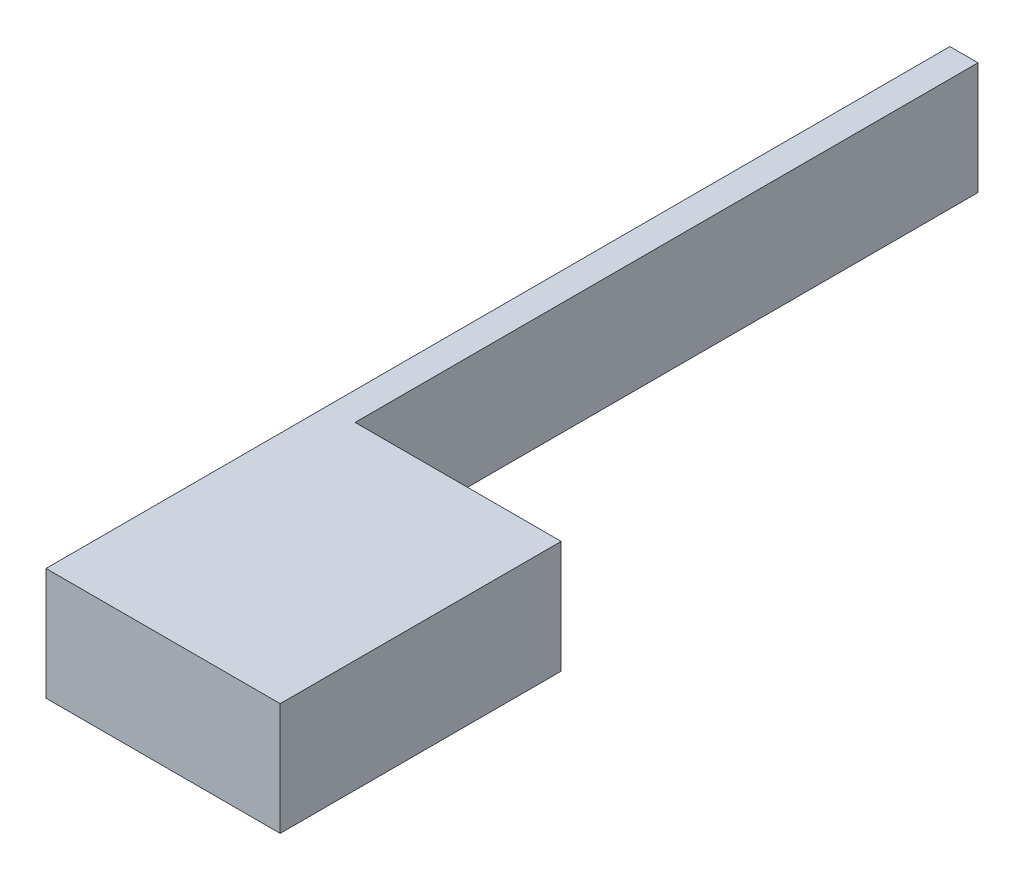
from build123d import *

# Parameters (mm, degrees)
SKETCH1_W           = 96.5
SKETCH1_H           = 12
BOSS_EXTRUDE1_DEPTH = 3
SKETCH2_W           = 30
SKETCH2_H           = 12
BOSS_EXTRUDE2_DEPTH = 22


with BuildPart() as part:
    # Sketch1 → Boss-Extrude1 (new body)
    with BuildSketch(Plane(origin=(0, 0, 0), x_dir=(0, 0, -1), z_dir=(1, 0, 0))):
        with Locations((48.25, 6)):
            Rectangle(SKETCH1_W, SKETCH1_H)
    extrude(amount=BOSS_EXTRUDE1_DEPTH)

    # Sketch2 → Boss-Extrude2 (add)
    with BuildSketch(Plane(origin=(3, 0, 0), x_dir=(0, 0, -1), z_dir=(1, 0, 0))):
        with Locations((15, 6)):
            Rectangle(SKETCH2_W, SKETCH2_H)
    extrude(amount=BOSS_EXTRUDE2_DEPTH)


solid = part.part
